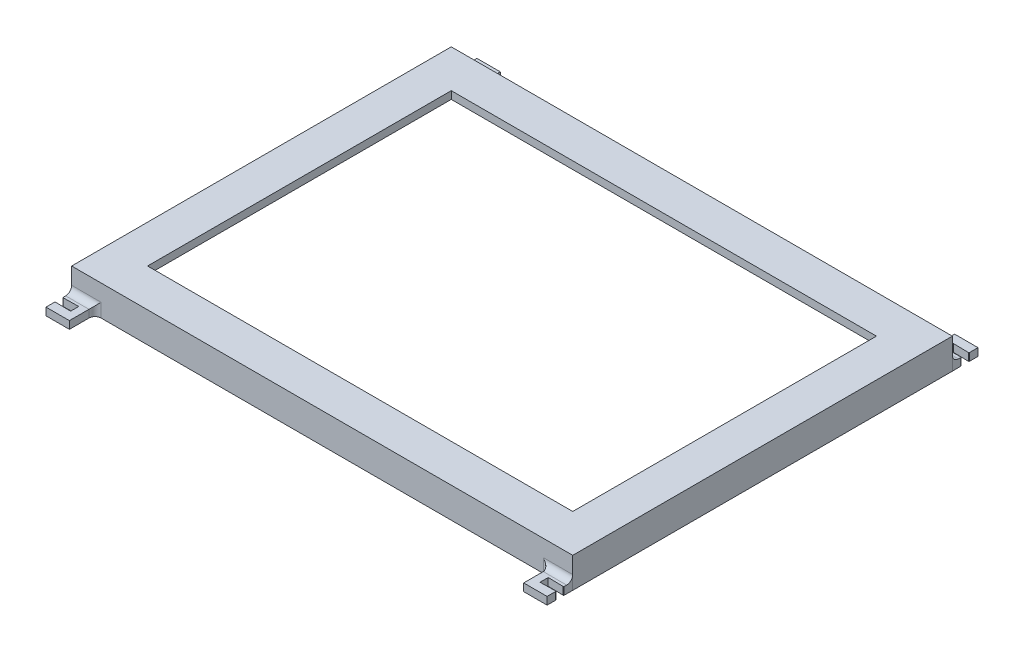
from build123d import *

# Parameters (mm, degrees)
SKETCH1_W               = 209.55
SKETCH1_H               = 158.75
SKETCH1_W_2             = 177.8
SKETCH1_H_2             = 127
FRONTFACE_DEPTH         = 3.175
SKETCH3_W               = 209.55
SKETCH3_H               = 158.75
SKETCH3_W_2             = 203.708
SKETCH3_H_2             = 152.908
SIDESHELL_DEPTH         = 9.525
BOTTOMSUPPORTLOCK_DEPTH = 3.175
FILLET1_R               = 2.54


with BuildPart() as part:
    # Sketch1 → FrontFace (new body)
    with BuildSketch(Plane(origin=(0, 9.525, 0), x_dir=(1, 0, 0), z_dir=(0, 1, 0))):
        with Locations((173.045515995, -23.140372536)):
            Rectangle(SKETCH1_W, SKETCH1_H)
        with Locations((173.045515995, -23.140372536)):
            Rectangle(SKETCH1_W_2, SKETCH1_H_2, mode=Mode.SUBTRACT)
    extrude(amount=FRONTFACE_DEPTH)

    # Sketch3 → SideShell (add)
    with BuildSketch(Plane.XZ.offset(-9.525)):
        with Locations((173.045515995, 23.140372536)):
            Rectangle(SKETCH3_W, SKETCH3_H)
        with Locations((173.045515995, 23.140372536)):
            Rectangle(SKETCH3_W_2, SKETCH3_H_2, mode=Mode.SUBTRACT)
    extrude(amount=SIDESHELL_DEPTH)

    # Sketch9 → BottomSupportLock (add)
    with BuildSketch(Plane.XZ):
        with BuildLine():
            Line((277.820515995, 102.515372536), (268.036564976, 102.515372536))
            Line((268.036564976, 102.515372536), (268.036564976, 113.237616687))
            Line((268.036564976, 113.237616687), (277.820515995, 113.237616687))
            Line((277.820515995, 113.237616687), (277.820515995, 109.721147351))
            ThreePointArc((277.820515995, 109.721147351), (277.744362054, 109.539800226), (277.561564976, 109.467195608))
            Line((277.561564976, 109.467195608), (271.211564976, 109.590994612))
            Line((271.211564976, 109.590994612), (271.211564976, 106.161994612))
            Line((271.211564976, 106.161994612), (277.520350721, 106.282567338))
            ThreePointArc((277.520350721, 106.282567338), (277.702016533, 106.210968908), (277.779186707, 106.031598992))
            Line((277.779186707, 106.031598992), (277.820515995, 102.515372536))
        make_face()
        with BuildLine():
            Line((277.779186707, -59.750853919), (277.820515995, -56.234627464))
            Line((277.820515995, -56.234627464), (268.036564976, -56.234627464))
            Line((268.036564976, -56.234627464), (268.036564976, -66.956871614))
            Line((268.036564976, -66.956871614), (277.820515995, -66.956871614))
            Line((277.820515995, -66.956871614), (277.820515995, -63.440402278))
            ThreePointArc((277.820515995, -63.440402278), (277.744362054, -63.259055154), (277.561564976, -63.186450536))
            Line((277.561564976, -63.186450536), (271.211564976, -63.310249539))
            Line((271.211564976, -63.310249539), (271.211564976, -59.881249539))
            Line((271.211564976, -59.881249539), (277.520350721, -60.001822265))
            ThreePointArc((277.520350721, -60.001822265), (277.702016533, -59.930223835), (277.779186707, -59.750853919))
        make_face()
        with BuildLine():
            Line((68.270515995, -56.234627464), (78.054467015, -56.234627464))
            Line((78.054467015, -56.234627464), (78.054467015, -66.956871614))
            Line((78.054467015, -66.956871614), (68.270515995, -66.956871614))
            Line((68.270515995, -66.956871614), (68.270515995, -63.440402278))
            ThreePointArc((68.270515995, -63.440402278), (68.346669937, -63.259055154), (68.529467015, -63.186450536))
            Line((68.529467015, -63.186450536), (74.879467015, -63.310249539))
            Line((74.879467015, -63.310249539), (74.879467015, -59.881249539))
            Line((74.879467015, -59.881249539), (68.57068127, -60.001822265))
            ThreePointArc((68.57068127, -60.001822265), (68.389015458, -59.930223835), (68.311845284, -59.750853919))
            Line((68.311845284, -59.750853919), (68.270515995, -56.234627464))
        make_face()
        with BuildLine():
            Line((68.311845284, 106.031598992), (68.270515995, 102.515372536))
            Line((68.270515995, 102.515372536), (78.054467015, 102.515372536))
            Line((78.054467015, 102.515372536), (78.054467015, 113.237616687))
            Line((78.054467015, 113.237616687), (68.270515995, 113.237616687))
            Line((68.270515995, 113.237616687), (68.270515995, 109.721147351))
            ThreePointArc((68.270515995, 109.721147351), (68.346669937, 109.539800226), (68.529467015, 109.467195608))
            Line((68.529467015, 109.467195608), (74.879467015, 109.590994612))
            Line((74.879467015, 109.590994612), (74.879467015, 106.161994612))
            Line((74.879467015, 106.161994612), (68.57068127, 106.282567338))
            ThreePointArc((68.57068127, 106.282567338), (68.389015458, 106.210968908), (68.311845284, 106.031598992))
        make_face()
    extrude(amount=-BOTTOMSUPPORTLOCK_DEPTH)

    # Fillet1
    fillet1_edges = [part.edges().sort_by_distance(p)[0] for p in [
        (73.162491505, 3.175, 102.515372536),
        (78.054467015, 1.5875, 102.515372536),
        (272.928540486, 3.175, 102.515372536),
        (268.036564976, 1.5875, 102.515372536),
        (272.928540486, 3.175, -56.234627464),
        (268.036564976, 1.5875, -56.234627464),
        (73.162491505, 3.175, -56.234627464),
        (78.054467015, 1.5875, -56.234627464),
    ]]
    fillet(fillet1_edges, radius=FILLET1_R)


solid = part.part
